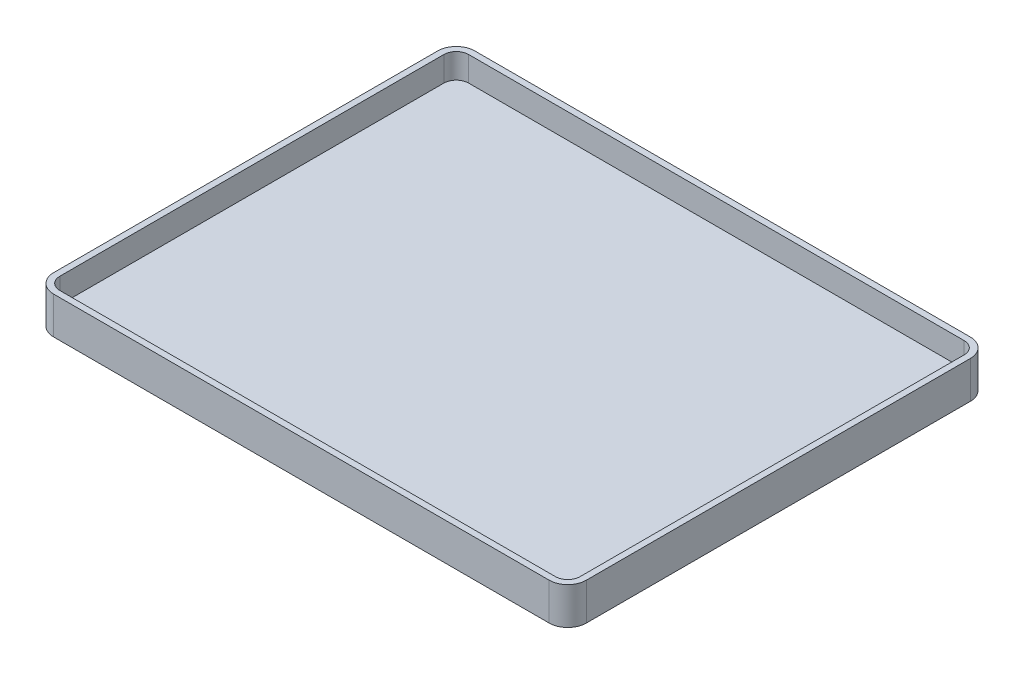
from build123d import *

# Parameters (mm, degrees)
SKETCH1_W           = 273.05
SKETCH1_H           = 215.9
BOSS_EXTRUDE1_DEPTH = 19.05
FILLET1_R           = 9.525
CUT_EXTRUDE1_DEPTH  = 12.7


with BuildPart() as part:
    # Sketch1 → Boss-Extrude1 (new body)
    with BuildSketch(Plane(origin=(0, 0, 0), x_dir=(1, 0, 0), z_dir=(0, 1, 0))):
        with Locations((136.525, 107.95)):
            Rectangle(SKETCH1_W, SKETCH1_H)
    extrude(amount=BOSS_EXTRUDE1_DEPTH)

    # Fillet1
    fillet1_edges = [part.edges().sort_by_distance(p)[0] for p in [
        (0, 9.525, -215.9),
        (273.05, 9.525, -215.9),
        (273.05, 9.525, 0),
        (0, 9.525, 0),
    ]]
    fillet(fillet1_edges, radius=FILLET1_R)

    # Sketch3 → Cut-Extrude1 (cut)
    with BuildSketch(Plane(origin=(0, 19.05, 0), x_dir=(1, 0, 0), z_dir=(0, 1, 0))):
        with BuildLine():
            Line((269.875, 9.525), (269.875, 206.375))
            ThreePointArc((269.875, 206.375), (268.015128061, 210.865128061), (263.525, 212.725))
            Line((263.525, 212.725), (9.525, 212.725))
            ThreePointArc((9.525, 212.725), (5.034871939, 210.865128061), (3.175, 206.375))
            Line((3.175, 206.375), (3.175, 9.525))
            ThreePointArc((3.175, 9.525), (5.034871939, 5.034871939), (9.525, 3.175))
            Line((9.525, 3.175), (263.525, 3.175))
            ThreePointArc((263.525, 3.175), (268.015128061, 5.034871939), (269.875, 9.525))
        make_face()
    extrude(amount=-CUT_EXTRUDE1_DEPTH, mode=Mode.SUBTRACT)


solid = part.part
